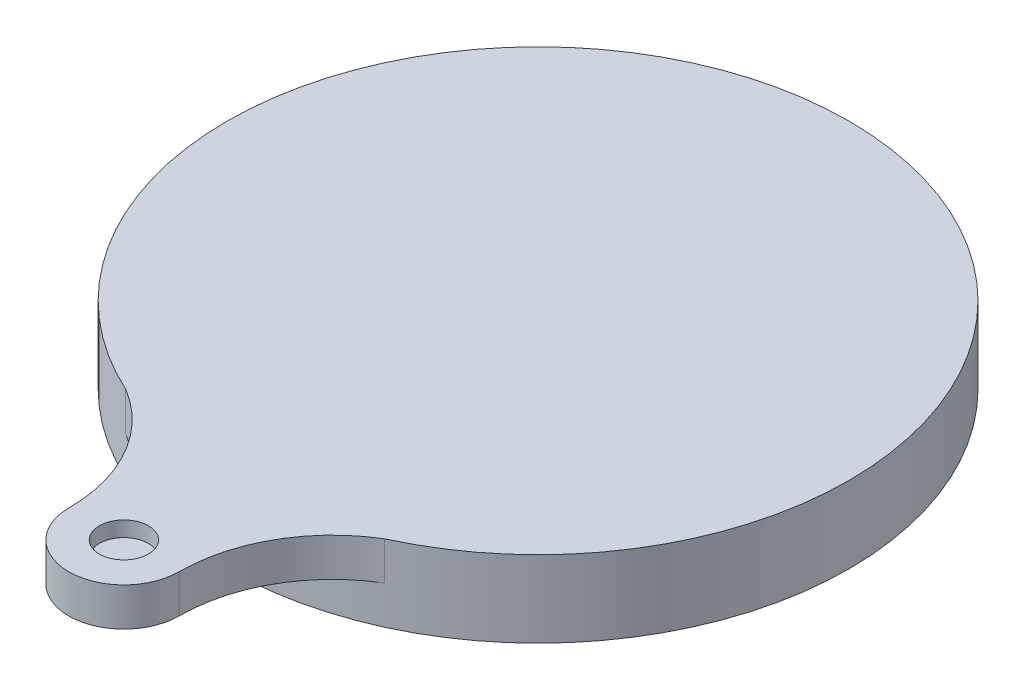
from build123d import *

# Parameters (mm, degrees)
SKETCH1_R           = 203
BOSS_EXTRUDE1_DEPTH = 50
BOSS_EXTRUDE2_START = -25
BOSS_EXTRUDE2_DEPTH = 25
SKETCH3_R           = 16
CUT_EXTRUDE1_DEPTH  = 10


with BuildPart() as part:
    # Sketch1 → Boss-Extrude1 (new body)
    with BuildSketch(Plane(origin=(0, 0, 0), x_dir=(1, 0, 0), z_dir=(0, 1, 0))):
        with Locations(Location((0, 0, 0), (0, 0, 270))):
            Circle(SKETCH1_R)
    extrude(amount=BOSS_EXTRUDE1_DEPTH)

    # Sketch2 → Boss-Extrude2 (add)
    with BuildSketch(Plane(origin=(0, 50, 0), x_dir=(1, 0, 0), z_dir=(0, 1, 0)).offset(BOSS_EXTRUDE2_START)):
        with BuildLine():
            ThreePointArc((-36, -270.29723777), (0, -306.29723777), (36, -270.29723777))
            ThreePointArc((36, -270.29723777), (48.967534793, -221.049395178), (84.507, -184.574014831))
            ThreePointArc((84.507, -184.574014831), (0, -203), (-84.507, -184.574014831))
            ThreePointArc((-84.507, -184.574014831), (-48.967534793, -221.049395178), (-36, -270.29723777))
        make_face()
    extrude(amount=BOSS_EXTRUDE2_DEPTH)

    # Sketch3 → Cut-Extrude1 (cut)
    with BuildSketch(Plane(origin=(0, 50, 0), x_dir=(1, 0, 0), z_dir=(0, 1, 0))):
        with Locations(Location((0, -270.29723777, 0), (0, 0, 270))):
            Circle(SKETCH3_R)
    extrude(amount=-CUT_EXTRUDE1_DEPTH, mode=Mode.SUBTRACT)


solid = part.part
